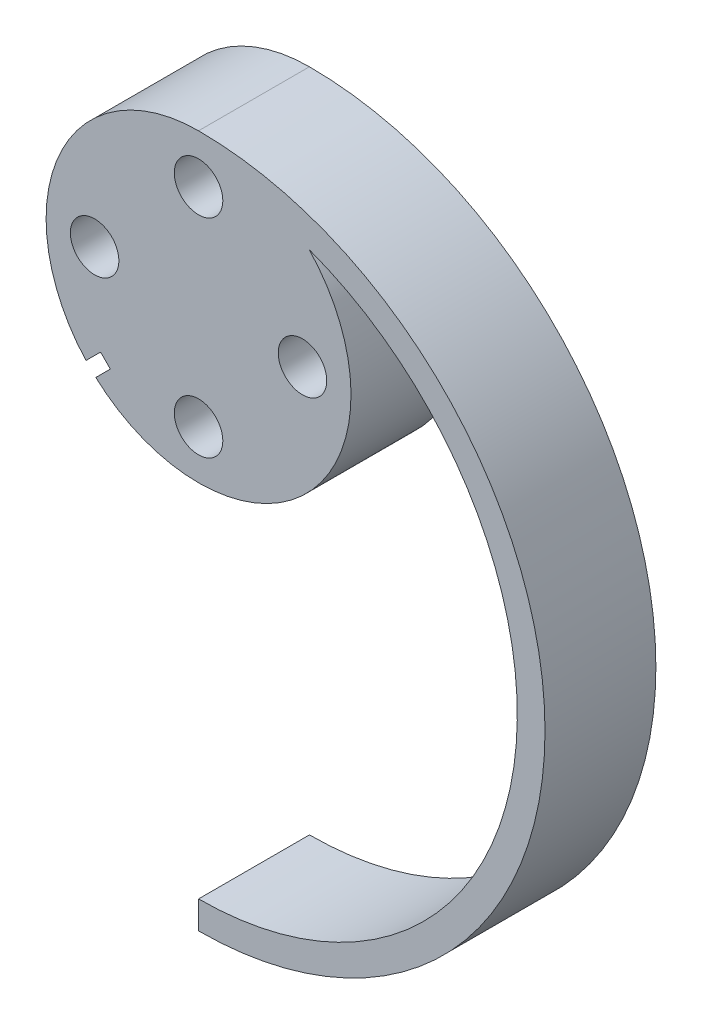
from build123d import *

# Parameters (mm, degrees)
SKETCH1_R               = 1.75
BOSS_EXTRUDE1_DEPTH     = 8
CUT_EXTRUDE1_DEPTH      = 48.010637094
CUT_EXTRUDE1_DEPTH_BACK = 48.010637094


with BuildPart() as part:
    # Sketch1 → Boss-Extrude1 (new body)
    with BuildSketch(Plane.XY):
        with BuildLine():
            Line((0, -39), (0, -37))
            ThreePointArc((0, -37), (22.640040384, -18.053217417), (7.979565739, 7.571428571))
            ThreePointArc((7.979565739, 7.571428571), (10.106574946, -4.342481187), (0, -11))
            ThreePointArc((0, -11), (-11, 0), (0, 11))
            ThreePointArc((0, 11), (25, -14), (0, -39))
        make_face()
        with Locations((0, 7.5)):
            Circle(SKETCH1_R, mode=Mode.SUBTRACT)
        with Locations((-7.5, 0)):
            Circle(SKETCH1_R, mode=Mode.SUBTRACT)
        with Locations((0, -7.5)):
            Circle(SKETCH1_R, mode=Mode.SUBTRACT)
        with Locations((7.5, 0)):
            Circle(SKETCH1_R, mode=Mode.SUBTRACT)
    extrude(amount=BOSS_EXTRUDE1_DEPTH)

    # Sketch2 → Cut-Extrude1 (cut, two sides: drawn at the far end of the back side and taken through both)
    with BuildSketch(Plane(origin=(0, 0, 0), x_dir=(-1, 0, 0), z_dir=(0, 0, -1)).offset(-CUT_EXTRUDE1_DEPTH_BACK)):
        Polygon((9.192388155, -8.485281374), (7.071067812, -6.363961031), (6.363961031, -7.071067812), (8.485281374, -9.192388155), align=None)
    extrude(amount=CUT_EXTRUDE1_DEPTH + CUT_EXTRUDE1_DEPTH_BACK, mode=Mode.SUBTRACT)


solid = part.part
